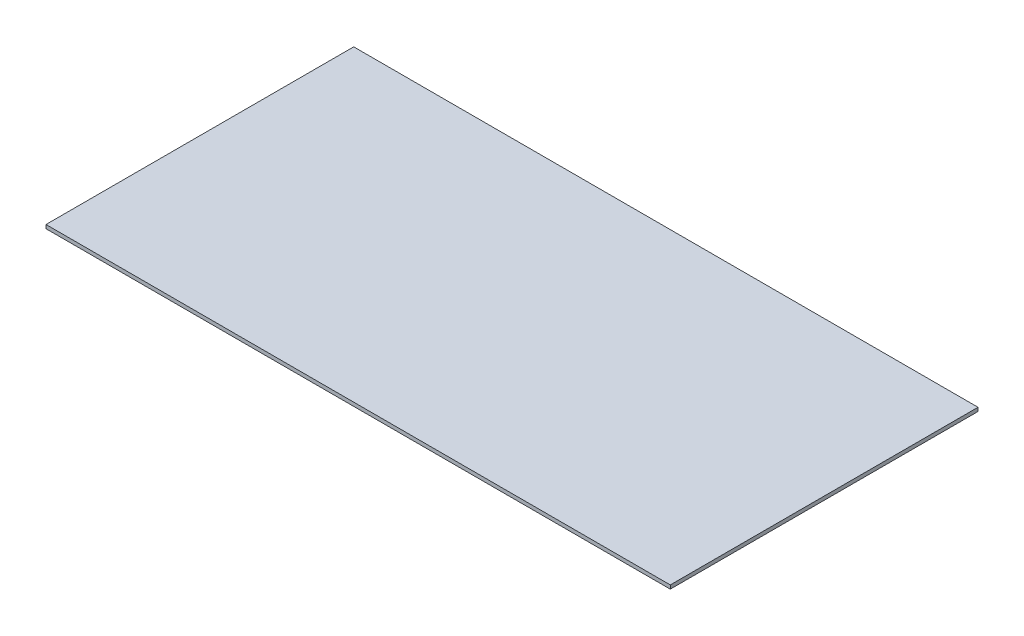
from build123d import *

# Parameters (mm, degrees)
SKETCH1_W           = 268.986
SKETCH1_H           = 132.588
BOSS_EXTRUDE1_DEPTH = 1.5875


with BuildPart() as part:
    # Sketch1 → Boss-Extrude1 (new body)
    with BuildSketch(Plane(origin=(0, 0, 0), x_dir=(1, 0, 0), z_dir=(0, 1, 0))):
        with Locations((134.493, 66.294)):
            Rectangle(SKETCH1_W, SKETCH1_H)
    extrude(amount=BOSS_EXTRUDE1_DEPTH)


solid = part.part
